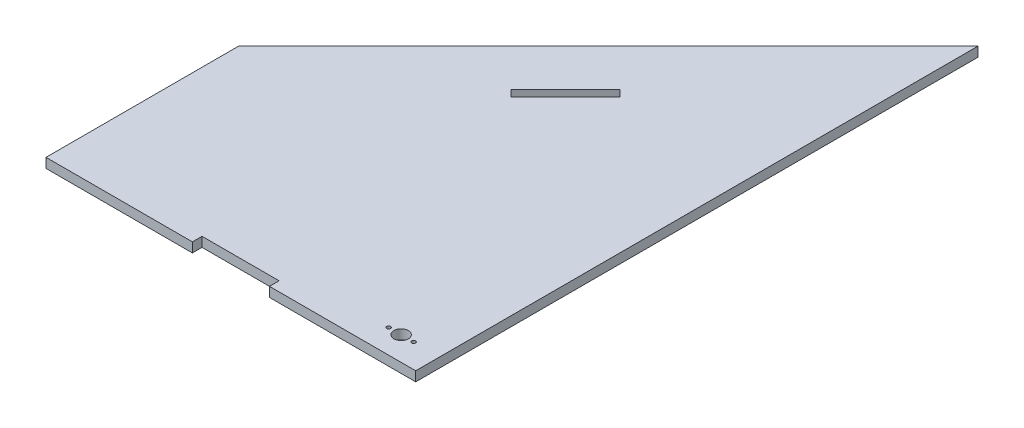
from build123d import *

# Parameters (mm, degrees)
BOSS_EXTRUDE1_DEPTH = 3.175
SKETCH2_R           = 2.38125
SKETCH2_R_2         = 0.635
SKETCH2_W           = 25.4
SKETCH2_H           = 3.175
CUT_EXTRUDE1_DEPTH  = 3.175


with BuildPart() as part:
    # Sketch1 → Boss-Extrude1 (new body)
    with BuildSketch(Plane(origin=(0, 0, 0), x_dir=(1, 0, 0), z_dir=(0, 1, 0))):
        Polygon((0, 63.5), (121.871664787, 185.371664787), (121.871664787, 121.549227353), (121.871664787, 0), (63.5, 0), (31.75, 0), (0, 0), align=None)
    extrude(amount=BOSS_EXTRUDE1_DEPTH)

    # Sketch2 → Cut-Extrude1 (cut)
    with BuildSketch(Plane(origin=(0, 3.175, 0), x_dir=(1, 0, 0), z_dir=(0, 1, 0))):
        with Locations(Location((109.171664787, 7.8994, 0), (0, 0, 270))):
            Circle(SKETCH2_R)
        with Locations(Location((105.044164787, 7.8994, 0), (0, 0, 270))):
            Circle(SKETCH2_R_2)
        with Locations(Location((113.299164787, 7.8994, 0), (0, 0, 270))):
            Circle(SKETCH2_R_2)
        Polygon((57.240266841, 96.06229437), (59.485330871, 93.81723034), (77.445843113, 111.777742582), (75.200779083, 114.022806612), align=None)
        with Locations((60.96, 1.5875)):
            Rectangle(SKETCH2_W, SKETCH2_H)
    extrude(amount=-CUT_EXTRUDE1_DEPTH, mode=Mode.SUBTRACT)


solid = part.part
